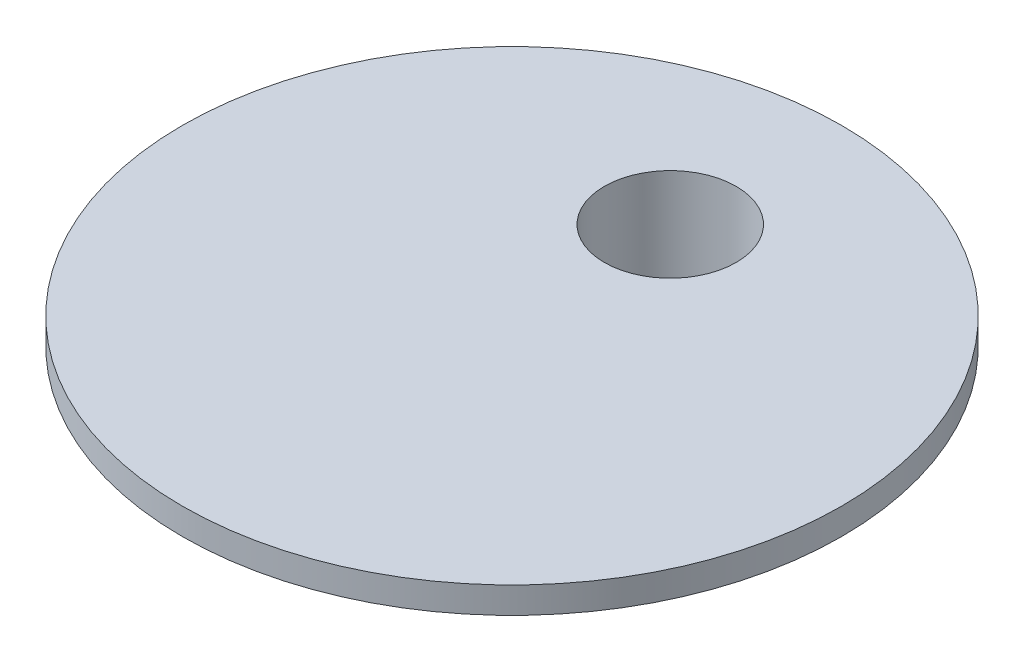
from build123d import *
from build123d.topology import SkipClean

# Parameters (mm, degrees)
SKETCH1_R           = 125
SKETCH1_R_2         = 25
BOSS_EXTRUDE1_DEPTH = 10
BOSS_EXTRUDE2_START = 85
SKETCH2_R           = 30
SKETCH2_R_2         = 25
BOSS_EXTRUDE2_DEPTH = 85


with BuildPart() as part:
    # Sketch1 → Boss-Extrude1 (new body)
    with BuildSketch(Plane(origin=(0, 0, 0), x_dir=(1, 0, 0), z_dir=(0, 1, 0))):
        with Locations(Location((0, 0, 0), (0, 0, 270))):
            Circle(SKETCH1_R)
        with Locations(Location((0, 60, 0), (0, 0, 270))):
            Circle(SKETCH1_R_2, mode=Mode.SUBTRACT)
    extrude(amount=BOSS_EXTRUDE1_DEPTH)

    # Sketch2 → Boss-Extrude2 (add)
    with SkipClean():  # the faces are left unmerged after this step: merging them gives an invalid solid
        with BuildSketch(Plane.XZ.offset(BOSS_EXTRUDE2_START)):
            with Locations(Location((0, -60, 0), (0, 0, 90))):
                Circle(SKETCH2_R)
            with Locations(Location((0, -60, 0), (0, 0, 270))):
                Circle(SKETCH2_R_2, mode=Mode.SUBTRACT)
        extrude(amount=-BOSS_EXTRUDE2_DEPTH)


solid = part.part
